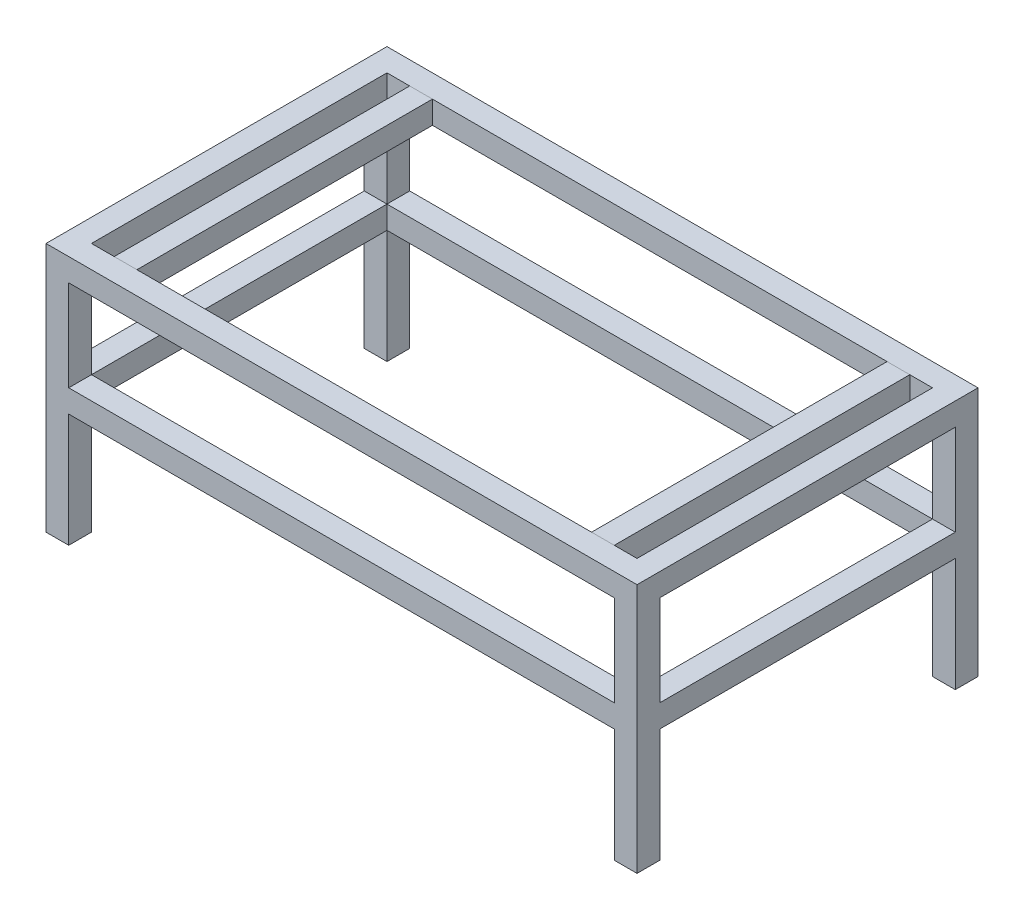
from build123d import *

# Parameters (mm, degrees)
ESQUISSE1_W             = 13000
ESQUISSE1_H             = 7500
ESQUISSE1_W_2           = 12000
ESQUISSE1_H_2           = 6500
BOSS_EXTRU_1_DEPTH      = 5500
ESQUISSE2_W             = 12000
ESQUISSE2_H             = 2000
ESQUISSE2_H_2           = 2500
ENL_V_MAT_EXTRU_1_DEPTH = 15985.367363146
ESQUISSE3_W             = 6500
ESQUISSE3_H             = 2000
ESQUISSE3_H_2           = 2500
ENL_V_MAT_EXTRU_2_DEPTH = 15985.367363146
ESQUISSE4_W             = 500
ESQUISSE4_H             = 6500
BOSS_EXTRU_2_DEPTH      = 500
BOSS_EXTRU_2_2_DEPTH    = 500


with BuildPart() as part:
    # Esquisse1 → Boss.-Extru.1 (new body)
    with BuildSketch(Plane(origin=(0, 0, 0), x_dir=(1, 0, 0), z_dir=(0, 1, 0))):
        with Locations((6500, 3750)):
            Rectangle(ESQUISSE1_W, ESQUISSE1_H)
        with Locations((6500, 3750)):
            Rectangle(ESQUISSE1_W_2, ESQUISSE1_H_2, mode=Mode.SUBTRACT)
    extrude(amount=-BOSS_EXTRU_1_DEPTH)

    # Esquisse2 → Enlèv. mat.-Extru.1 (cut, through all)
    with BuildSketch(Plane.XY):
        with Locations((6500, -1500)):
            Rectangle(ESQUISSE2_W, ESQUISSE2_H)
        with Locations((6500, -4250)):
            Rectangle(ESQUISSE2_W, ESQUISSE2_H_2)
    extrude(amount=-ENL_V_MAT_EXTRU_1_DEPTH, mode=Mode.SUBTRACT)

    # Esquisse3 → Enlèv. mat.-Extru.2 (cut, through all)
    with BuildSketch(Plane.ZY):
        with Locations((-3750, -1500)):
            Rectangle(ESQUISSE3_W, ESQUISSE3_H)
        with Locations((-3750, -4250)):
            Rectangle(ESQUISSE3_W, ESQUISSE3_H_2)
    extrude(amount=-ENL_V_MAT_EXTRU_2_DEPTH, mode=Mode.SUBTRACT)


with BuildPart() as body_2:
    # Esquisse4 → Boss.-Extru.2 (new body)
    with BuildSketch(Plane(origin=(0, 0, 0), x_dir=(1, 0, 0), z_dir=(0, 1, 0))):
        with Locations((1250, 3750)):
            Rectangle(ESQUISSE4_W, ESQUISSE4_H)
    extrude(amount=-BOSS_EXTRU_2_DEPTH)


with BuildPart() as body_3:
    # Esquisse4 → Boss.-Extru.2 2 (new body)
    with BuildSketch(Plane(origin=(0, 0, 0), x_dir=(1, 0, 0), z_dir=(0, 1, 0))):
        with Locations((11750, 3750)):
            Rectangle(ESQUISSE4_W, ESQUISSE4_H)
    extrude(amount=-BOSS_EXTRU_2_2_DEPTH)


solid = Compound([part.part, body_2.part, body_3.part])
